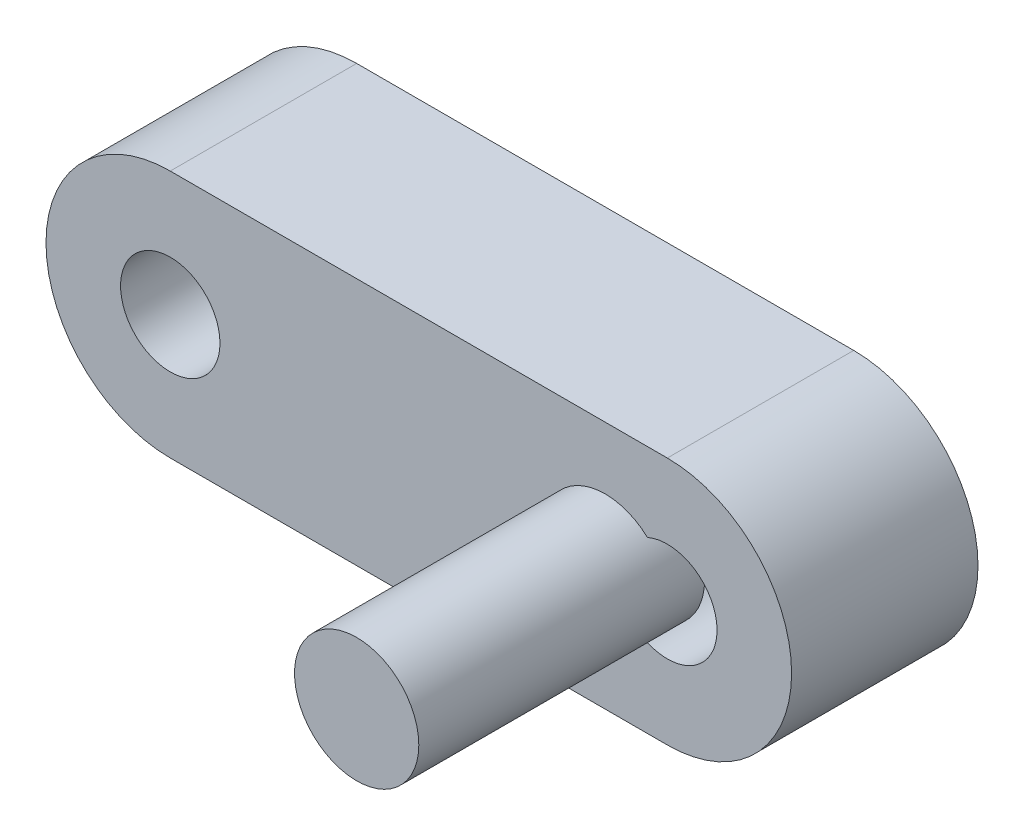
from build123d import *

# Parameters (mm, degrees)
SKETCH_1_R           = 2
EXTRUDE_1_DEPTH      = 7.5
EXTRUDE_2_DEPTH      = 10
EXTRUDE_2_DEPTH_BACK = 1.5
SKETCH_2_R           = 2.5
SKETCH_5_R           = 3.1
CUT_EXTRUDE_1_DEPTH  = 4


with BuildPart() as part:
    # 草圖1 → 填料-伸長1 (new body)
    with BuildSketch(Plane.XY):
        with BuildLine():
            Line((-10, 5), (10, 5))
            ThreePointArc((10, 5), (15, 0), (10, -5))
            Line((10, -5), (-10, -5))
            ThreePointArc((-10, -5), (-15, 0), (-10, 5))
        make_face()
        with Locations((-10, 0)):
            Circle(SKETCH_1_R, mode=Mode.SUBTRACT)
        with Locations((10, 0)):
            Circle(SKETCH_1_R, mode=Mode.SUBTRACT)
    extrude(amount=EXTRUDE_1_DEPTH)

    # 草圖2 → 填料-伸長2 (add, two sides: drawn at the far end of the back side and taken through both)
    with BuildSketch(Plane.XY.offset(7.5).offset(-EXTRUDE_2_DEPTH_BACK)):
        with Locations((7.5, 0)):
            Circle(SKETCH_2_R)
    extrude(amount=EXTRUDE_2_DEPTH + EXTRUDE_2_DEPTH_BACK)

    # 草圖5 → 除料-伸長1 (cut)
    with BuildSketch(Plane(origin=(0, 0, 0), x_dir=(-1, 0, 0), z_dir=(0, 0, -1))):
        with Locations((-10, 0)):
            Circle(SKETCH_5_R)
        Polygon((5.882234711, -2.799315774), (9.115395929, -2.800683725), (10.733161218, -0.001367951), (9.117765289, 2.799315774), (5.884604071, 2.800683725), (4.266838782, 0.001367951), align=None)
    extrude(amount=-CUT_EXTRUDE_1_DEPTH, mode=Mode.SUBTRACT)


solid = part.part
